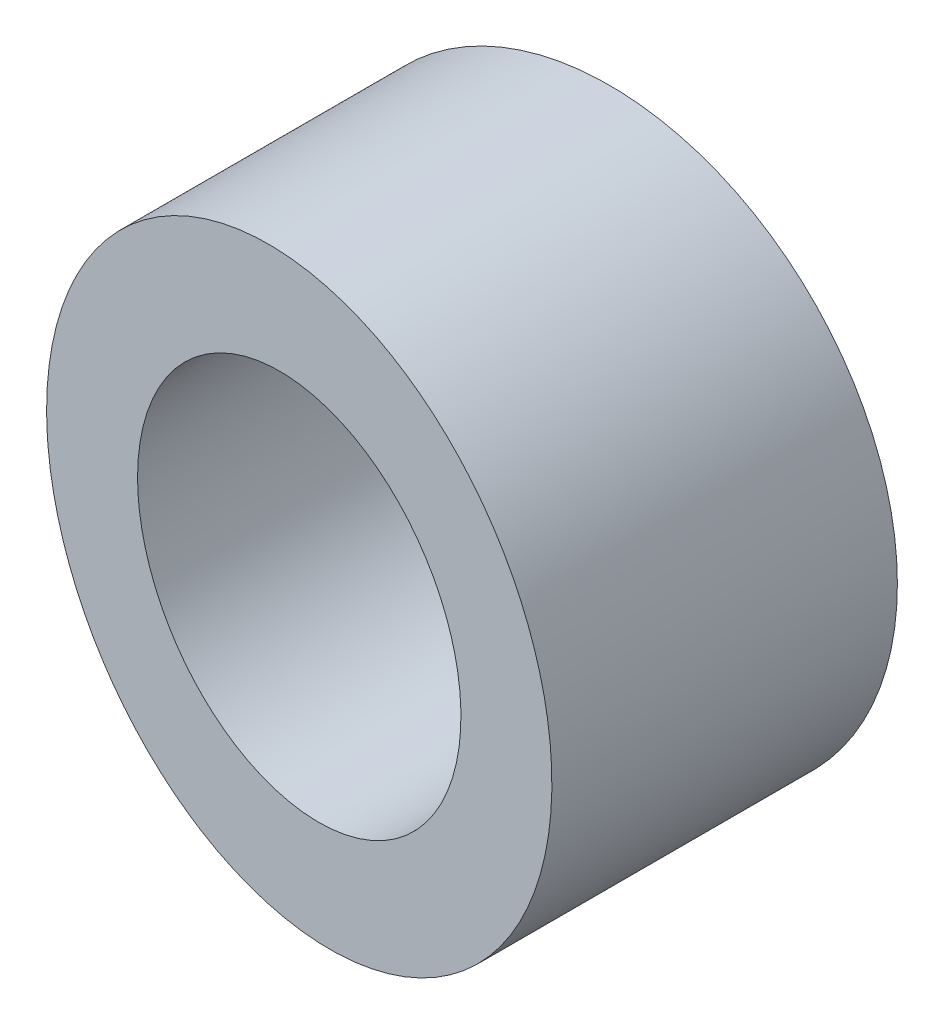
from build123d import *

# Parameters (mm, degrees)
SKETCH1_R           = 12.5
SKETCH1_R_2         = 8
BOSS_EXTRUDE1_DEPTH = 15
CUT_EXTRUDE1_DEPTH  = 103


with BuildPart() as part:
    # Sketch1 → Boss-Extrude1 (new body)
    with BuildSketch(Plane.XY):
        Circle(SKETCH1_R)
        Circle(SKETCH1_R_2, mode=Mode.SUBTRACT)
    extrude(amount=BOSS_EXTRUDE1_DEPTH)

    # Sketch2 → Cut-Extrude1 (cut, symmetric)
    with BuildSketch(Plane(origin=(0, 0, 0), x_dir=(1, 0, 0), z_dir=(0, 1, 0))):
        Polygon((-135.487207947, 3.128432974), (64.512792053, -21.371567026), (64.512792053, -148.371567026), (-135.487207947, -172.871567026), align=None)
    extrude(amount=CUT_EXTRUDE1_DEPTH, both=True, mode=Mode.SUBTRACT)


solid = part.part
